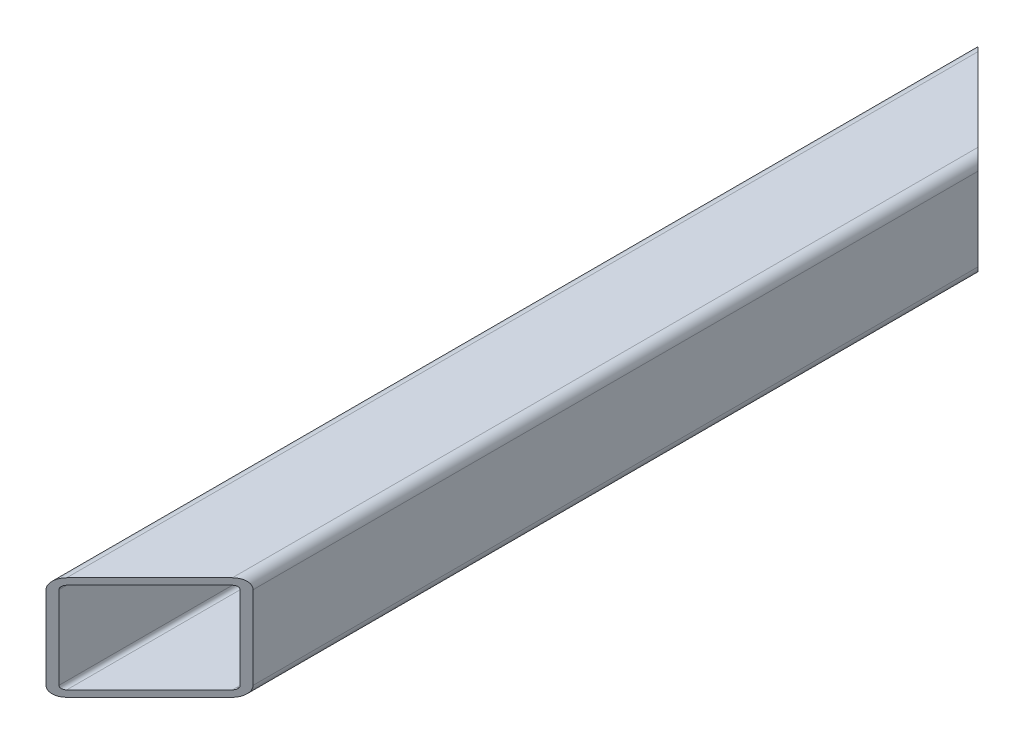
from build123d import *

# Parameters (mm, degrees)
DODANIE_WYCI_GNI_CIE1_DEPTH = 720
WYTNIJ_WYCI_GNI_CIE1_DEPTH  = 729.834686332


with BuildPart() as part:
    # Szkic1 → Dodanie-wyciągnięcie1 (new body)
    with BuildSketch(Plane.XY):
        with BuildLine():
            Line((8, 0), (72, 0))
            ThreePointArc((72, 0), (77.656854249, 2.343145751), (80, 8))
            Line((80, 8), (80, 72))
            ThreePointArc((80, 72), (77.656854249, 77.656854249), (72, 80))
            Line((72, 80), (8, 80))
            ThreePointArc((8, 80), (2.343145751, 77.656854249), (0, 72))
            Line((0, 72), (0, 8))
            ThreePointArc((0, 8), (2.343145751, 2.343145751), (8, 0))
        make_face()
        with BuildLine():
            Line((5, 8), (5, 72))
            ThreePointArc((5, 72), (5.878679656, 74.121320344), (8, 75))
            Line((8, 75), (72, 75))
            ThreePointArc((72, 75), (74.121320344, 74.121320344), (75, 72))
            Line((75, 72), (75, 8))
            ThreePointArc((75, 8), (74.121320344, 5.878679656), (72, 5))
            Line((72, 5), (8, 5))
            ThreePointArc((8, 5), (5.878679656, 5.878679656), (5, 8))
        make_face(mode=Mode.SUBTRACT)
    extrude(amount=-DODANIE_WYCI_GNI_CIE1_DEPTH)

    # Szkic2 → Wytnij-wyciągnięcie1 (cut, through all)
    with BuildSketch(Plane(origin=(0, 80, 0), x_dir=(1, 0, 0), z_dir=(0, 1, 0))):
        Polygon((0, 0), (80, 0), (80, 80), align=None)
        Polygon((80, 640), (0, 720), (80, 720), align=None)
    extrude(amount=-WYTNIJ_WYCI_GNI_CIE1_DEPTH, mode=Mode.SUBTRACT)


solid = part.part
